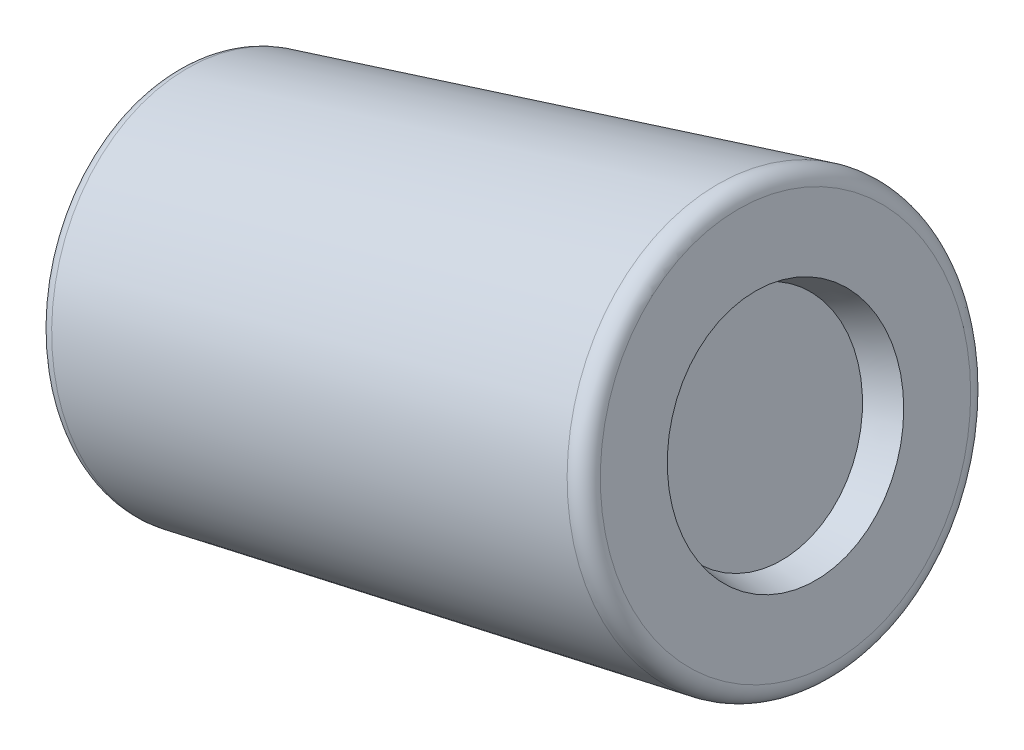
from build123d import *

# Parameters (mm, degrees)
ESQUISSE3_R             = 1.75
ENL_V_MAT_EXTRU_1_DEPTH = 0.5
ENL_V_MAT_EXTRU_1_DRAFT = -16
CONG_1_R                = 0.25


with BuildPart() as part:
    # Esquisse1 → Base-Révolution (revolve)
    with BuildSketch(Plane.XY, mode=Mode.PRIVATE) as base_r_volution_sk:
        Polygon((-3.894833669, 19.224673744), (-12.577919584, 16.857392814), (-13.2830375, 19.443735386), (-4.683927313, 22.119035716), align=None)
    revolve(base_r_volution_sk.sketch.rotate(Axis((3.55560583, 21.25589669, 0), (-0.9647873238288128, -0.2630312144579755, 0)), 180), axis=Axis((3.55560583, 21.25589669, 0), (-0.9647873238288128, -0.2630312144579755, 0)))


with BuildPart() as enl_v_mat_extru_1_tool:
    # Esquisse3 → Enlèv. mat.-Extru.1 (with draft: the straight prism first)
    with BuildSketch(Plane(origin=(1.253261753, 0.341678371, 0), x_dir=(0, 0, -1), z_dir=(0.9647873238288128, 0.26303121445797556, 0))):
        with Locations((0, 19.572184363)):
            Circle(ESQUISSE3_R)
    extrude(amount=-ENL_V_MAT_EXTRU_1_DEPTH)
    # Enlèv. mat.-Extru.1: the draft: its side faces are tilted about the plane it starts from
    enl_v_mat_extru_1_sides = [enl_v_mat_extru_1_tool.faces().sort_by_distance(p)[0] for p in [
        (-4.1360305, 19.158915941, 1.75),
    ]]
    draft(enl_v_mat_extru_1_sides, Plane(origin=(1.253261753, 0.341678371, 0), x_dir=(0, 0, -1), z_dir=(0.9647873238288128, 0.26303121445797556, 0)), ENL_V_MAT_EXTRU_1_DRAFT)


with BuildPart() as part_1:
    add(part.part)

    # Enlèv. mat.-Extru.1: cut by enl_v_mat_extru_1_tool
    add(enl_v_mat_extru_1_tool.part, mode=Mode.SUBTRACT)

    # Congé1
    cong_1_edges = [part_1.edges().sort_by_distance(p)[0] for p in [
        (-13.2830375, 19.443735386, 0),
        (-4.683927313, 22.119035716, 0),
    ]]
    fillet(cong_1_edges, radius=CONG_1_R)


solid = part_1.part
